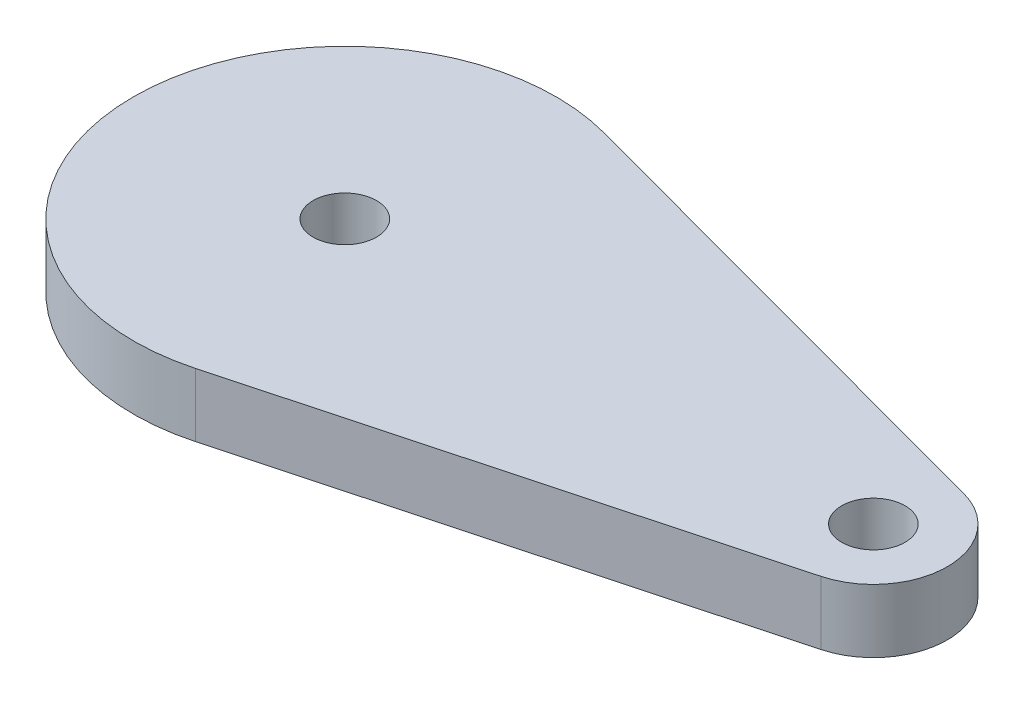
from build123d import *

# Parameters (mm, degrees)
SKETCH3_R           = 1.5
BOSS_EXTRUDE1_DEPTH = 3


with BuildPart() as part:
    # Sketch3 → Boss-Extrude1 (new body)
    with BuildSketch(Plane(origin=(0, 0, 0), x_dir=(1, 0, 0), z_dir=(0, 1, 0))):
        with BuildLine():
            Line((-22.4, -2.843913836), (0.91, -9.120369843))
            ThreePointArc((0.91, -9.120369843), (3.5, -12.5), (0.91, -15.879630157))
            Line((0.91, -15.879630157), (-22.4, -22.156086164))
            ThreePointArc((-22.4, -22.156086164), (-35, -12.5), (-22.4, -2.843913836))
        make_face()
        with Locations(Location((0, -12.5, 0), (0, 0, 270))):
            Circle(SKETCH3_R, mode=Mode.SUBTRACT)
        with Locations(Location((-25, -12.5, 0), (0, 0, 270))):
            Circle(SKETCH3_R, mode=Mode.SUBTRACT)
    extrude(amount=BOSS_EXTRUDE1_DEPTH)


solid = part.part
